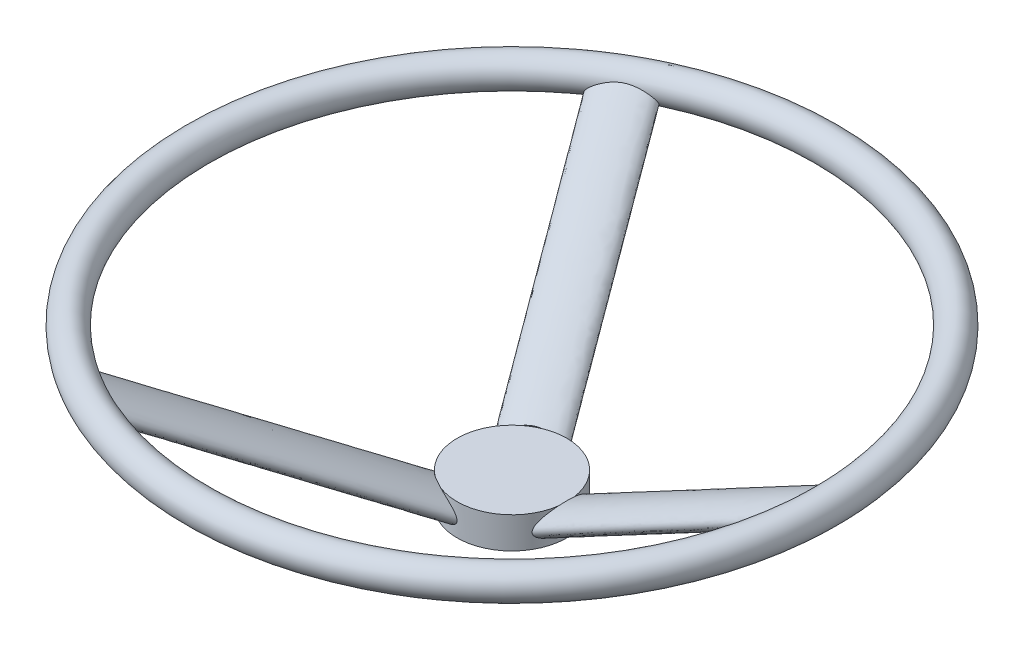
from build123d import *
from build123d.topology import SkipClean

# Parameters (mm, degrees)
SKETCH1_R                = 10
SKETCH1_W                = 35
SKETCH1_H                = 20
BOSS_EXTRUDE1_REACH      = 473.381
BOSS_EXTRUDE1_END_RADIUS = 35
SKETCH3_RX               = 17.5
SKETCH3_RY               = 7.5
CIRPATTERN1_COUNT        = 3


with BuildPart() as part:
    # Sketch1 → Revolve1 (revolve)
    with BuildSketch(Plane.XY, mode=Mode.PRIVATE) as revolve1_sk:
        with Locations((200, 100)):
            Circle(SKETCH1_R)
        with Locations((17.5, 10)):
            Rectangle(SKETCH1_W, SKETCH1_H)
    revolve(revolve1_sk.sketch.rotate(Axis((0, 0, 0), (0, 1, 0)), 90), axis=Axis((0, 0, 0), (0, 1, 0)))

    # Boss-Extrude1: up to this cylinder (the profile starts outside it)
    boss_extrude1_end = Plane(origin=(0, 100.03461, 0), z_dir=(0, -1, 0)) * Cylinder(BOSS_EXTRUDE1_END_RADIUS, 1017.762, mode=Mode.PRIVATE)
    # Sketch3 → Boss-Extrude1 (add, up to the surface)
    with BuildSketch(Plane(origin=(200, 100, 0), x_dir=(0.47058823529411764, -0.8823529411764706, 0), z_dir=(0.8823529411764706, 0.47058823529411764, 0)), mode=Mode.PRIVATE) as boss_extrude1_sk1:
        with Locations(Location((-0.039225201, 0), (0, 0, 90))):
            Ellipse(SKETCH3_RX, SKETCH3_RY)
    boss_extrude1_tool1 = extrude(boss_extrude1_sk1.sketch, amount=-BOSS_EXTRUDE1_REACH, mode=Mode.PRIVATE) - boss_extrude1_end
    boss_extrude1 = boss_extrude1_tool1.solids().sort_by_distance((199.981541, 100.03461, 0))[0]
    add(boss_extrude1)

    # CirPattern1: Boss-Extrude1 ×3 about axis
    with SkipClean():  # the faces are left unmerged after this step: merging them gives an invalid solid
        cirpattern1_axis = Axis((0, 20, 0), (0, -1, 0))
        for i in range(1, CIRPATTERN1_COUNT):
            add(boss_extrude1.rotate(cirpattern1_axis, i * 360 / CIRPATTERN1_COUNT))


solid = part.part
